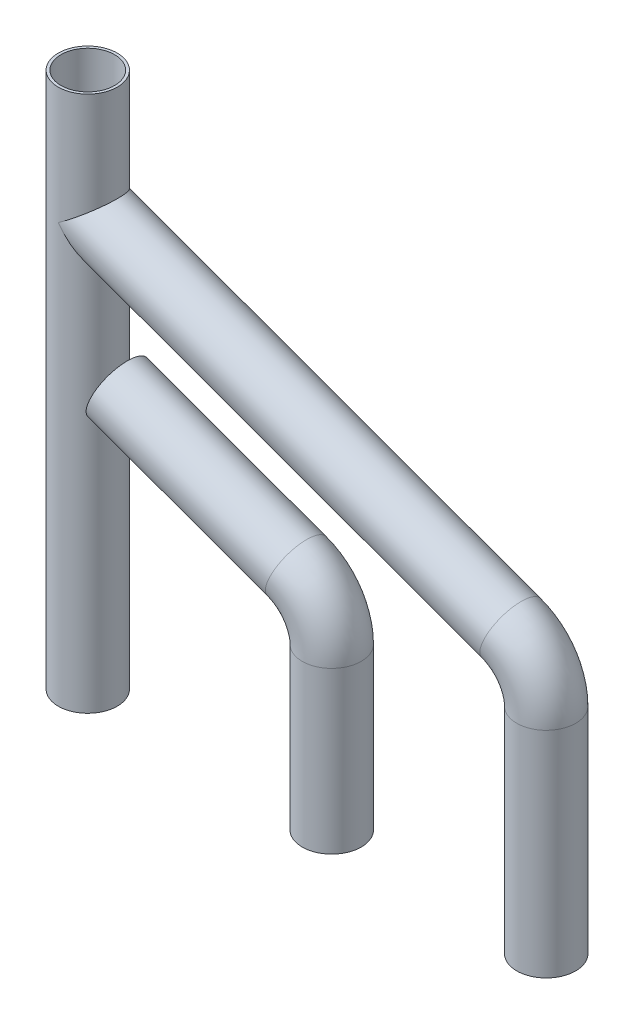
from build123d import *

# Parameters (mm, degrees)
SKETCH1_R                = 6.985
SKETCH1_R_2              = 6.35
BOSS_EXTRUDE1_DEPTH      = 127
SKETCH3_R                = 6.985
SKETCH3_R_2              = 6.35
BOSS_EXTRUDE3_REACH      = 171.672
BOSS_EXTRUDE3_END_RADIUS = 6.985
SKETCH6_R                = 6.985
SKETCH9_R                = 6.985
SKETCH9_R_2              = 6.35


with BuildPart() as part:
    # Sketch1 → Boss-Extrude1 (new body)
    with BuildSketch(Plane(origin=(0, 0, 0), x_dir=(1, 0, 0), z_dir=(0, 1, 0))):
        with Locations(Location((0, 0, 0), (0, 0, 270))):
            Circle(SKETCH1_R)
        with Locations(Location((0, 0, 0), (0, 0, 270))):
            Circle(SKETCH1_R_2, mode=Mode.SUBTRACT)
    extrude(amount=BOSS_EXTRUDE1_DEPTH)



with BuildPart() as body_2:
    # Sweep10: sweep along a path in Sketch2
    with BuildLine(Plane.XY) as sweep10_path:
        Line((108.585, 0), (108.585, 50.8))
        ThreePointArc((108.585, 50.8), (106.288230962, 58.084420742), (100.22865582, 62.734096284))
    # Sketch3 → Sweep10 (sweep)
    with BuildSketch(Plane(origin=(108.585, 0, 0), x_dir=(-1, 0, 0), z_dir=(0, -1, 0))):
        Circle(SKETCH3_R)
        Circle(SKETCH3_R_2, mode=Mode.SUBTRACT)
    sweep(path=sweep10_path.line)


with BuildPart() as part_1:
    add(part.part)

    add(body_2.part)  # Boss-Extrude3 merges body 2
    # Boss-Extrude3: up to this cylinder (the profile starts outside it)
    boss_extrude3_end = Plane(origin=(0, 62.734096, 0), z_dir=(0, -1, 0)) * Cylinder(BOSS_EXTRUDE3_END_RADIUS, 358.314, mode=Mode.PRIVATE)
    # Sketch6 → Boss-Extrude3 (add, up to the surface)
    with BuildSketch(Plane(origin=(68.341780428, -24.874373833, 0), x_dir=(0, 0, 1), z_dir=(-0.9396926207859093, 0.3420201433256665, 0)), mode=Mode.PRIVATE) as boss_extrude3_sk1:
        with Locations(Location((0, 93.230986579, 0), (0, 0, 90))):
            Circle(SKETCH6_R)
    boss_extrude3_tool1 = extrude(boss_extrude3_sk1.sketch, amount=BOSS_EXTRUDE3_REACH, mode=Mode.PRIVATE) - boss_extrude3_end
    add(boss_extrude3_tool1.solids().sort_by_distance((100.228656, 62.734096, 0))[0])

    # Sweep14: sweep along a path in Sketch8
    with BuildLine(Plane.XY) as sweep14_path:
        Line((6.985, 65.482323636), (49.42865582, 50.034096284))
        ThreePointArc((49.42865582, 50.034096284), (55.488230962, 45.384420742), (57.785, 38.1))
        Line((57.785, 38.1), (57.785, 0))
    # Sketch9 → Sweep14 (sweep)
    with BuildSketch(Plane(origin=(57.785, 0, 0), x_dir=(-1, 0, 0), z_dir=(0, -1, 0))):
        Circle(SKETCH9_R)
        Circle(SKETCH9_R_2, mode=Mode.SUBTRACT)
    sweep(path=sweep14_path.line)


solid = part_1.part
